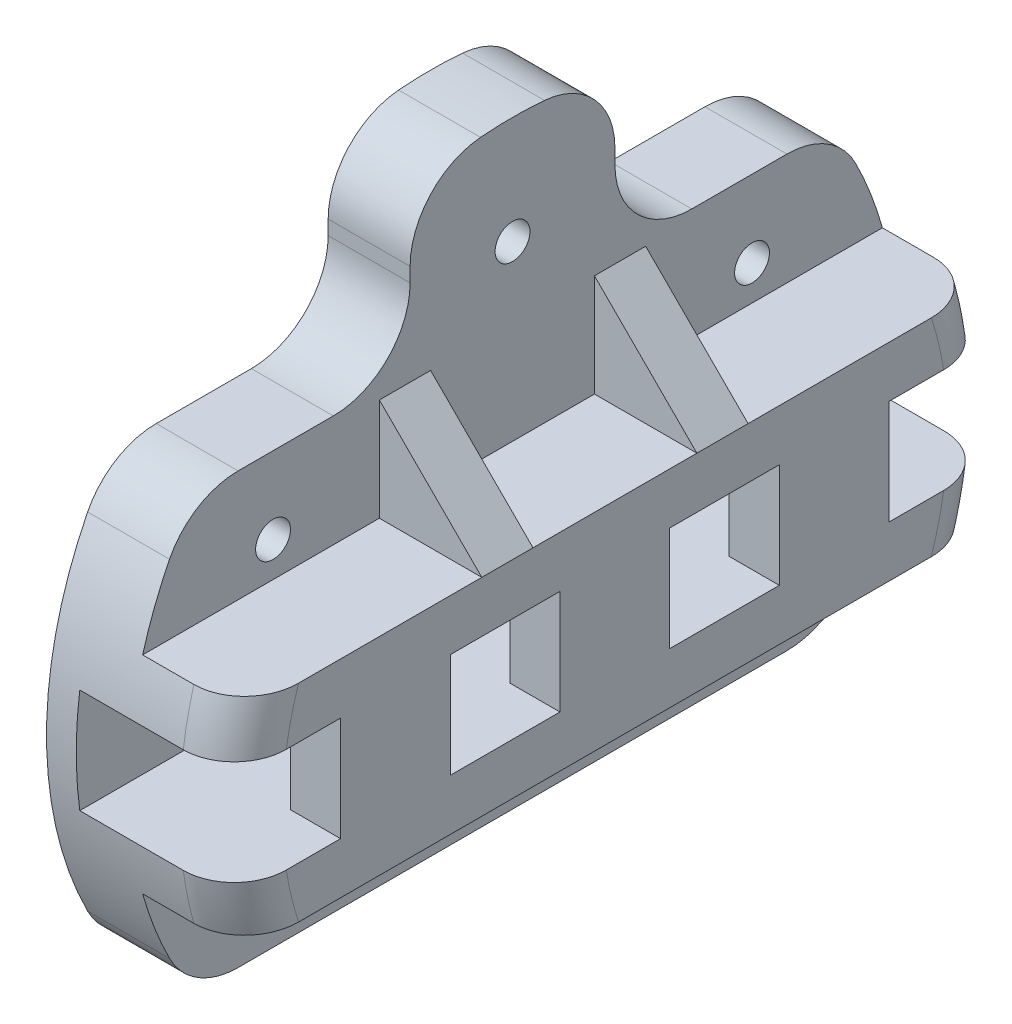
from build123d import *

# Parameters (mm, degrees)
SKETCH1_R               = 37.5
SKETCH1_R_2             = 1.7
BOSS_EXTRUDE1_DEPTH     = 20
CUT_EXTRUDE1_DEPTH      = 57.678920244
CUT_EXTRUDE1_DEPTH_BACK = 57.678920244
SKETCH2_W               = 10.2
SKETCH2_H               = 10.2
CUT_EXTRUDE2_START      = -10
SKETCH3_R               = 1.7
CUT_EXTRUDE2_DEPTH      = 10
CUT_EXTRUDE4_START      = -10
SKETCH4_W               = 10.71
SKETCH4_H               = 10.2
CUT_EXTRUDE4_DEPTH      = 10
BOSS_EXTRUDE2_START     = 8
BOSS_EXTRUDE2_DEPTH     = 5
SKETCH7_R               = 3
CUT_EXTRUDE5_DEPTH      = 5
SKETCH8_R               = 1.7
CUT_EXTRUDE6_DEPTH      = 15
FILLET1_R               = 5
SKETCH9_R               = 37.5
CUT_EXTRUDE7_DEPTH      = 2
CUT_EXTRUDE8_START      = -10
CUT_EXTRUDE8_DEPTH      = 10
FILLET3_R               = 7.5


with BuildPart() as part:
    # Sketch1 → Boss-Extrude1 (new body)
    with BuildSketch(Plane(origin=(0, 0, 0), x_dir=(0, 0, -1), z_dir=(1, 0, 0))):
        Circle(SKETCH1_R)
        with Locations((0, 27)):
            Circle(SKETCH1_R_2, mode=Mode.SUBTRACT)
        with Locations((23.382685902, -13.5)):
            Circle(SKETCH1_R_2, mode=Mode.SUBTRACT)
        with Locations((-23.382685902, -13.5)):
            Circle(SKETCH1_R_2, mode=Mode.SUBTRACT)
    extrude(amount=BOSS_EXTRUDE1_DEPTH)

    # Sketch2 → Cut-Extrude1 (cut, two sides: drawn at the far end of the back side and taken through both)
    with BuildSketch(Plane.XY.offset(-CUT_EXTRUDE1_DEPTH_BACK)):
        with Locations((10, 0)):
            Rectangle(SKETCH2_W, SKETCH2_H)
    extrude(amount=CUT_EXTRUDE1_DEPTH + CUT_EXTRUDE1_DEPTH_BACK, mode=Mode.SUBTRACT)

    # Sketch3 → Cut-Extrude2 (cut)
    # profile 1 of 2: a face of its own
    with BuildSketch(Plane(origin=(20, 0, 0), x_dir=(0, 0, -1), z_dir=(1, 0, 0)).offset(CUT_EXTRUDE2_START)):
        with BuildLine():
            Line((-36.11426311, 10.1), (36.11426311, 10.1))
            ThreePointArc((36.11426311, 10.1), (0, 37.5), (-36.11426311, 10.1))
        make_face()
        with Locations((0, 27)):
            Circle(SKETCH3_R, mode=Mode.SUBTRACT)
    # profile 2 of 2: a face of its own
    with BuildSketch(Plane(origin=(20, 0, 0), x_dir=(0, 0, -1), z_dir=(1, 0, 0)).offset(CUT_EXTRUDE2_START)):
        with BuildLine():
            ThreePointArc((-36.11426311, -10.1), (0, -37.5), (36.11426311, -10.1))
            Line((36.11426311, -10.1), (-36.11426311, -10.1))
        make_face()
        with Locations((-23.382685902, -13.5)):
            Circle(SKETCH3_R, mode=Mode.SUBTRACT)
        with Locations((23.382685902, -13.5)):
            Circle(SKETCH3_R, mode=Mode.SUBTRACT)
    extrude(amount=CUT_EXTRUDE2_DEPTH, mode=Mode.SUBTRACT)

    # Sketch4 → Cut-Extrude4 (cut)
    with BuildSketch(Plane(origin=(20, 0, 0), x_dir=(0, 0, -1), z_dir=(1, 0, 0)).offset(CUT_EXTRUDE4_START)):
        with BuildLine():
            Line((-26.79, -5.1), (-26.79, 5.1))
            Line((-26.79, 5.1), (-37.151581393, 5.1))
            ThreePointArc((-37.151581393, 5.1), (-37.5, 0), (-37.151581393, -5.1))
            Line((-37.151581393, -5.1), (-26.79, -5.1))
        make_face()
        with Locations((-10.725, 0)):
            Rectangle(SKETCH4_W, SKETCH4_H)
        with Locations((10.695, 0)):
            Rectangle(SKETCH4_W, SKETCH4_H)
        with BuildLine():
            Line((37.151581393, 5.1), (26.76, 5.1))
            Line((26.76, 5.1), (26.76, -5.1))
            Line((26.76, -5.1), (37.151581393, -5.1))
            ThreePointArc((37.151581393, -5.1), (37.5, 0), (37.151581393, 5.1))
        make_face()
    extrude(amount=CUT_EXTRUDE4_DEPTH, mode=Mode.SUBTRACT)

    # Sketch6 → Boss-Extrude2 (add)
    with BuildSketch(Plane.XY.offset(BOSS_EXTRUDE2_START)):
        Polygon((20, 10.1), (10, 20.1), (10, 10.1), align=None)
        Polygon((10, -20.1), (10, -10.1), (20, -10.1), align=None)
    boss_extrude2 = extrude(amount=BOSS_EXTRUDE2_DEPTH)

    # Mirror1: Boss-Extrude2 across plane
    add(boss_extrude2.mirror(Plane.XY))

    # Sketch7 → Cut-Extrude5 (cut)
    with BuildSketch(Plane.ZY):
        with Locations((23.382685902, 13.5)):
            Circle(SKETCH7_R)
        with Locations((0, -27)):
            Circle(SKETCH7_R)
        with Locations((-23.382685902, 13.5)):
            Circle(SKETCH7_R)
    extrude(amount=-CUT_EXTRUDE5_DEPTH, mode=Mode.SUBTRACT)

    # Sketch8 → Cut-Extrude6 (cut)
    with BuildSketch(Plane.ZY):
        with Locations((-23.382685902, 13.5)):
            Circle(SKETCH8_R)
        with Locations((23.382685902, 13.5)):
            Circle(SKETCH8_R)
        with Locations((0, -27)):
            Circle(SKETCH8_R)
    extrude(amount=-CUT_EXTRUDE6_DEPTH, mode=Mode.SUBTRACT)

    # Fillet1
    fillet1_edges = [part.edges().sort_by_distance(p)[0] for p in [
        (20, 7.617677291, 36.718128938),
        (20, -7.617677291, 36.718128938),
        (20, -7.617677291, -36.718128938),
        (20, 7.617677291, -36.718128938),
    ]]
    fillet(fillet1_edges, radius=FILLET1_R)

    # Sketch9 → Cut-Extrude7 (cut)
    with BuildSketch(Plane.ZY):
        Circle(SKETCH9_R)
    extrude(amount=-CUT_EXTRUDE7_DEPTH, mode=Mode.SUBTRACT)

    # Sketch10 → Cut-Extrude8 (cut)
    with BuildSketch(Plane(origin=(10, 0, 0), x_dir=(0, 0, -1), z_dir=(1, 0, 0)).offset(CUT_EXTRUDE8_START)):
        with BuildLine():
            Line((31.068472766, -21), (-31.068472766, -21))
            ThreePointArc((-31.068472766, -21), (0, -37.5), (31.068472766, -21))
        make_face()
        with BuildLine():
            ThreePointArc((-10, 36.142080737), (-21.885509272, 30.451181979), (-31.068472766, 21))
            Line((-31.068472766, 21), (-10, 21))
            Line((-10, 21), (-10, 36.142080737))
        make_face()
        with BuildLine():
            Line((10, 21), (31.068472766, 21))
            ThreePointArc((31.068472766, 21), (21.885509272, 30.451181979), (10, 36.142080737))
            Line((10, 36.142080737), (10, 21))
        make_face()
    extrude(amount=CUT_EXTRUDE8_DEPTH, mode=Mode.SUBTRACT)

    # Fillet3
    fillet3_edges = [part.edges().sort_by_distance(p)[0] for p in [
        (6, 21, 10),
        (6, 21, -10),
        (6, -21, 31.068472766),
        (6, -21, -31.068472766),
        (6, 21, -31.068472766),
        (6, 36.142080737, -10),
        (6, 21, 31.068472766),
        (6, 36.142080737, 10),
    ]]
    fillet(fillet3_edges, radius=FILLET3_R)


solid = part.part
